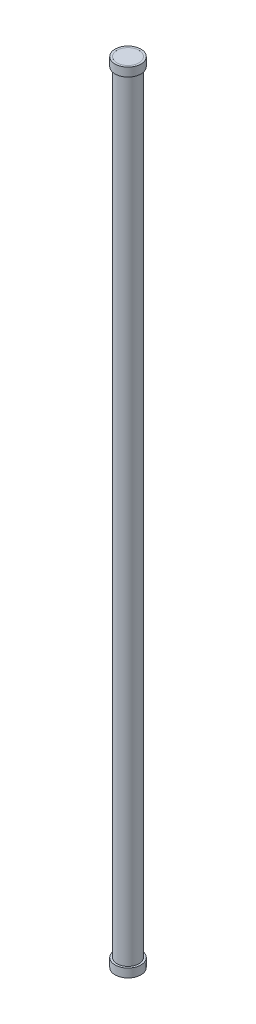
from build123d import *

# Parameters (mm, degrees)
CROQUIS1_R              = 12.7
SALIENTE_EXTRUIR1_DEPTH = 915
CROQUIS2_R              = 15
CROQUIS2_R_2            = 12.7
SALIENTE_EXTRUIR2_DEPTH = 10
CROQUIS3_R              = 15
CROQUIS3_R_2            = 12.7
SALIENTE_EXTRUIR3_DEPTH = 10


with BuildPart() as part:
    # Croquis1 → Saliente-Extruir1 (new body)
    with BuildSketch(Plane(origin=(0, 0, 0), x_dir=(1, 0, 0), z_dir=(0, 1, 0))):
        with Locations(Location((0, 0, 0), (0, 0, 90))):
            Circle(CROQUIS1_R)
    extrude(amount=SALIENTE_EXTRUIR1_DEPTH)

    # Croquis3 → Saliente-Extruir3 (add)
    with BuildSketch(Plane.XZ):
        with Locations(Location((0, 0, 0), (0, 0, 90))):
            Circle(CROQUIS3_R)
        with Locations(Location((0, 0, 0), (0, 0, 90))):
            Circle(CROQUIS3_R_2, mode=Mode.SUBTRACT)
    extrude(amount=-SALIENTE_EXTRUIR3_DEPTH)


with BuildPart() as body_2:
    # Croquis2 → Saliente-Extruir2 (new body)
    with BuildSketch(Plane(origin=(0, 915, 0), x_dir=(1, 0, 0), z_dir=(0, 1, 0))):
        with Locations(Location((0, 0, 0), (0, 0, 270))):
            Circle(CROQUIS2_R)
        with Locations(Location((0, 0, 0), (0, 0, 270))):
            Circle(CROQUIS2_R_2, mode=Mode.SUBTRACT)
    extrude(amount=-SALIENTE_EXTRUIR2_DEPTH)


solid = Compound([part.part, body_2.part])
